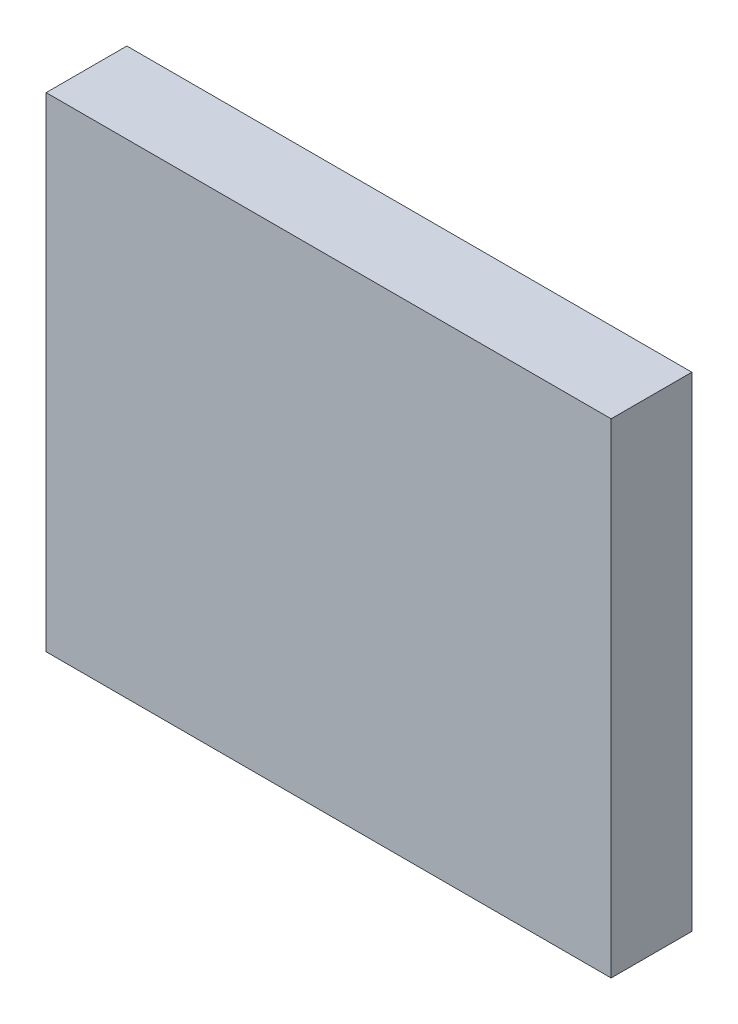
from build123d import *

# Parameters (mm, degrees)
CROQUIS_BASE_W             = 175
CROQUIS_BASE_H             = 25
MURO_DEPTH                 = 150
CROQUIS_AGUJEROS_MONTAJE_R = 4
AGUJERO_INSERTO_M6_DEPTH   = 14


with BuildPart() as part:
    # Croquis_base → Muro (new body)
    with BuildSketch(Plane(origin=(0, 0, 0), x_dir=(1, 0, 0), z_dir=(0, 1, 0))):
        Rectangle(CROQUIS_BASE_W, CROQUIS_BASE_H)
    extrude(amount=MURO_DEPTH)

    # Croquis_agujeros_montaje → Agujero_inserto_M6 (cut)
    with BuildSketch(Plane(origin=(0, 0, 0), x_dir=(1, 0, 0), z_dir=(0, 1, 0))):
        with Locations(Location((-50, 0, 0), (0, 0, 270))):
            Circle(CROQUIS_AGUJEROS_MONTAJE_R)
        with Locations(Location((50, 0, 0), (0, 0, 270))):
            Circle(CROQUIS_AGUJEROS_MONTAJE_R)
    extrude(amount=AGUJERO_INSERTO_M6_DEPTH, mode=Mode.SUBTRACT)


solid = part.part
